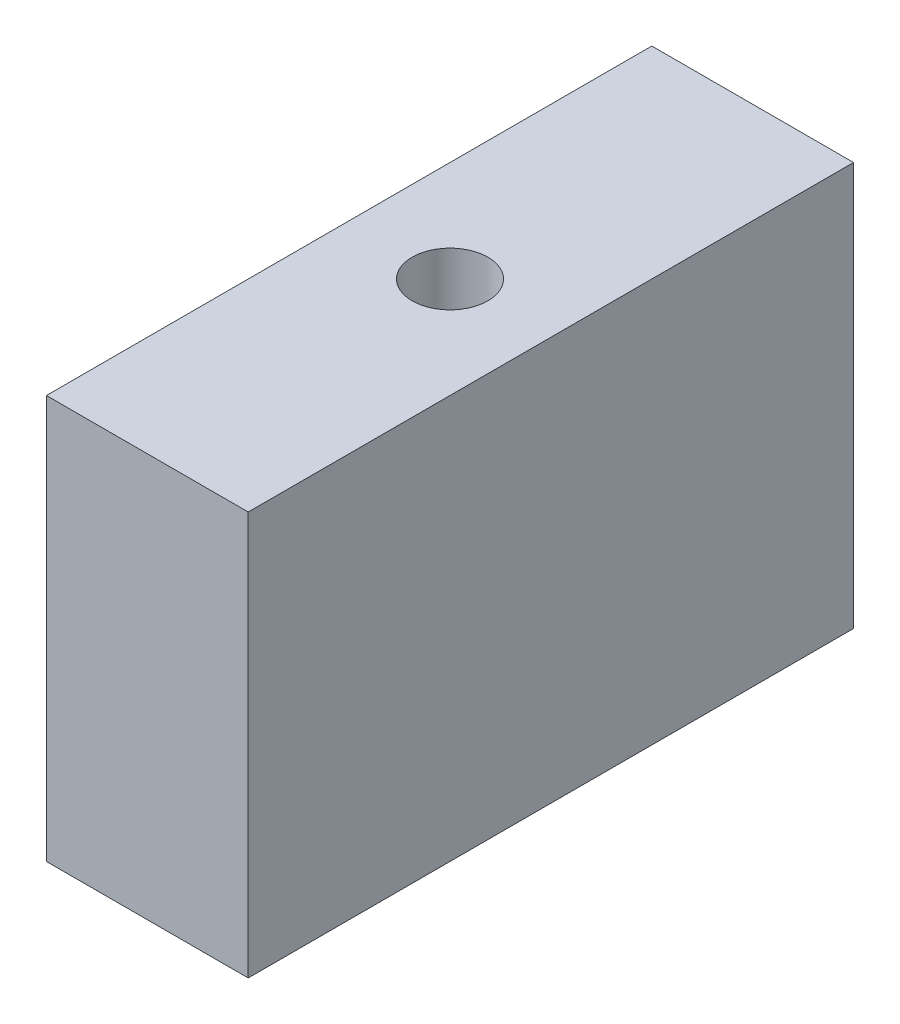
from build123d import *

# Parameters (mm, degrees)
SKETCH1_W             = 3.175
SKETCH1_H             = 9.525
BOSS_EXTRUDE1_DEPTH   = 6.35
F_0_80_TAPPED_HOLE1_D = 1.19126


with BuildPart() as part:
    # Sketch1 → Boss-Extrude1 (new body)
    with BuildSketch(Plane(origin=(0, 0, 0), x_dir=(1, 0, 0), z_dir=(0, 1, 0))):
        Rectangle(SKETCH1_W, SKETCH1_H)
    extrude(amount=BOSS_EXTRUDE1_DEPTH)

    # #0-80 Tapped Hole1 (through all)
    with Locations(Plane(origin=(0, 6.35, 0), x_dir=(1, 0, 0), z_dir=(0, 1, 0))):
        with Locations((0, 0)):
            Hole(F_0_80_TAPPED_HOLE1_D / 2)


solid = part.part
